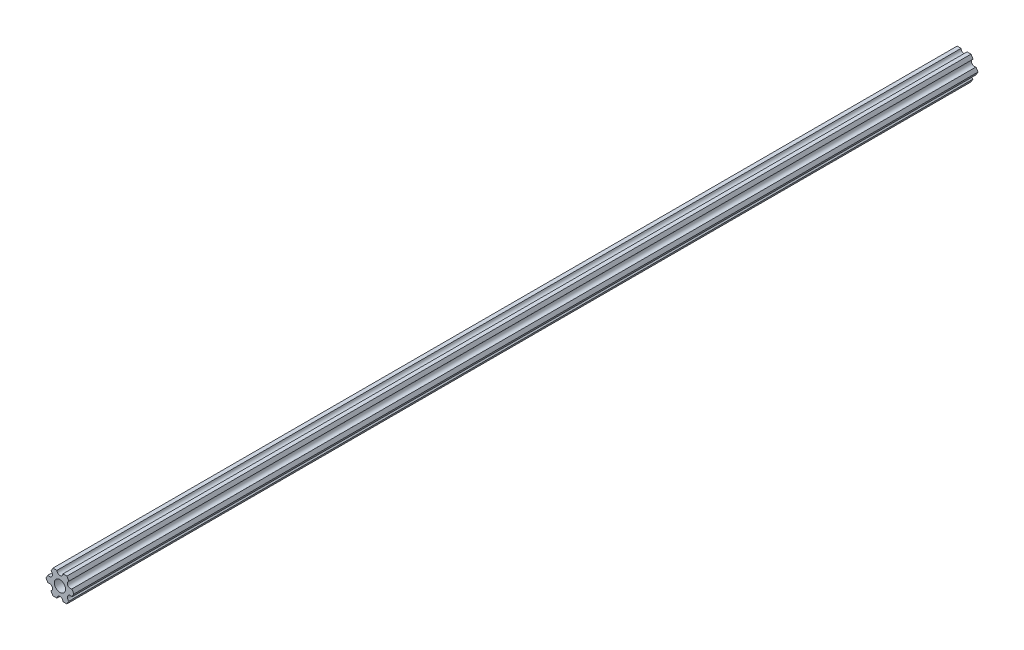
from build123d import *

# Parameters (mm, degrees)
SKETCH1_R           = 2.9337
BOSS_EXTRUDE1_DEPTH = 463.55
MOVE_FACE1_BY       = 12.7


with BuildPart() as part:
    # Sketch1 → Boss-Extrude1 (new body)
    with BuildSketch(Plane.XY.offset(231.775)):
        with BuildLine():
            Line((6.293011699, -1.800184894), (7.332348803, -2.22e-07))
            Line((7.332348803, -2.22e-07), (6.293011439, 1.800184522))
            ThreePointArc((6.293011439, 1.800184522), (4.124446058, 2.381249653), (4.705511189, 4.549815034))
            Line((4.705511189, 4.549815034), (3.666173825, 6.349999778))
            Line((3.666173825, 6.349999778), (1.587499615, 6.349999778))
            ThreePointArc((1.587499615, 6.349999778), (-3.85e-07, 4.762499778), (-1.587500385, 6.349999778))
            Line((-1.587500385, 6.349999778), (-3.666174594, 6.349999778))
            Line((-3.666174594, 6.349999778), (-4.70551159, 4.549815043))
            ThreePointArc((-4.70551159, 4.549815043), (-4.12444613, 2.38124975), (-6.293011423, 1.80018429))
            Line((-6.293011423, 1.80018429), (-7.332348419, -4.44e-07))
            Line((-7.332348419, -4.44e-07), (-6.293011205, -1.800185053))
            ThreePointArc((-6.293011205, -1.800185053), (-4.124445841, -2.38125025), (-4.705511038, -4.549815614))
            Line((-4.705511038, -4.549815614), (-3.666173825, -6.350000222))
            Line((-3.666173825, -6.350000222), (-1.587499615, -6.350000222))
            ThreePointArc((-1.587499615, -6.350000222), (3.85e-07, -4.762500222), (1.587500385, -6.350000222))
            Line((1.587500385, -6.350000222), (3.666174594, -6.350000222))
            Line((3.666174594, -6.350000222), (4.705511699, -4.549815551))
            ThreePointArc((4.705511699, -4.549815551), (4.12444637, -2.381250222), (6.293011699, -1.800184894))
        make_face()
        with Locations(Location((0, 0, 0), (0, 0, 180))):
            Circle(SKETCH1_R, mode=Mode.SUBTRACT)
    extrude(amount=-BOSS_EXTRUDE1_DEPTH)

    # Move Face1: a face moved outward by 12.7
    extrude(part.faces().sort_by_distance((1.92e-07, -3.175000222, 231.775))[0], amount=MOVE_FACE1_BY, dir=(0, 0, 1))


solid = part.part
